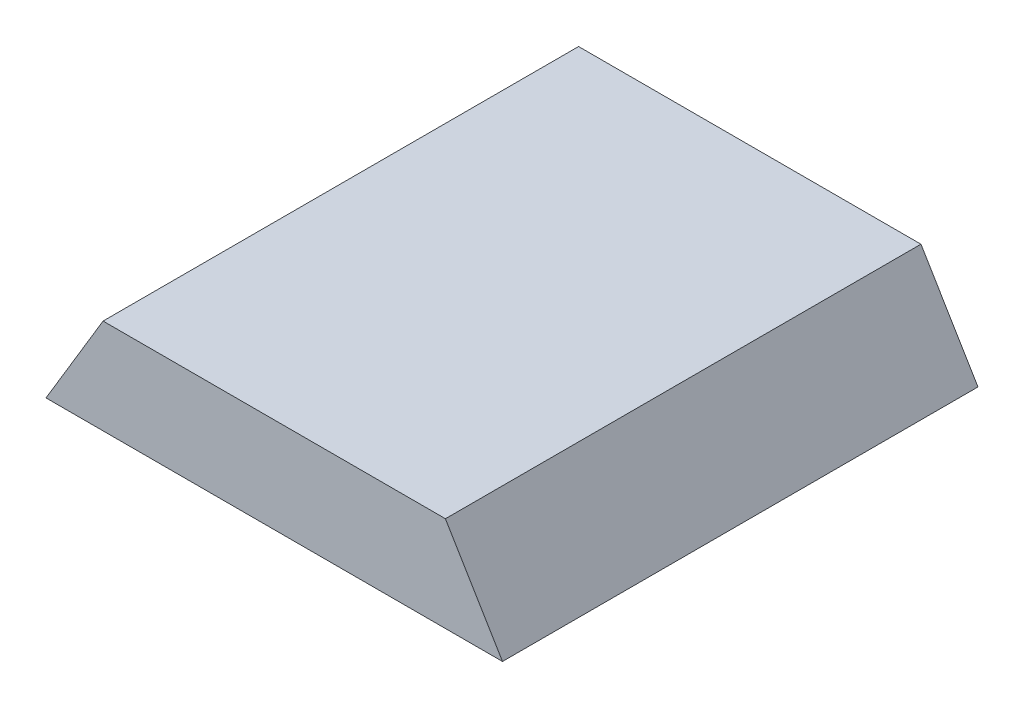
from build123d import *

# Parameters (mm, degrees)
BOSS_EXTRUDE1_DEPTH = 250
SKETCH2_R           = 7.5
CUT_EXTRUDE1_DEPTH  = 10


with BuildPart() as part:
    # Sketch1 → Boss-Extrude1 (new body)
    with BuildSketch(Plane.XY):
        Polygon((-120, 0), (120, 0), (90, 50), (-90, 50), align=None)
    extrude(amount=-BOSS_EXTRUDE1_DEPTH)

    # Sketch2 → Cut-Extrude1 (cut)
    with BuildSketch(Plane.XZ):
        with Locations(Location((0, -120, 0), (0, 0, 270))):
            Circle(SKETCH2_R)
    extrude(amount=-CUT_EXTRUDE1_DEPTH, mode=Mode.SUBTRACT)


solid = part.part
